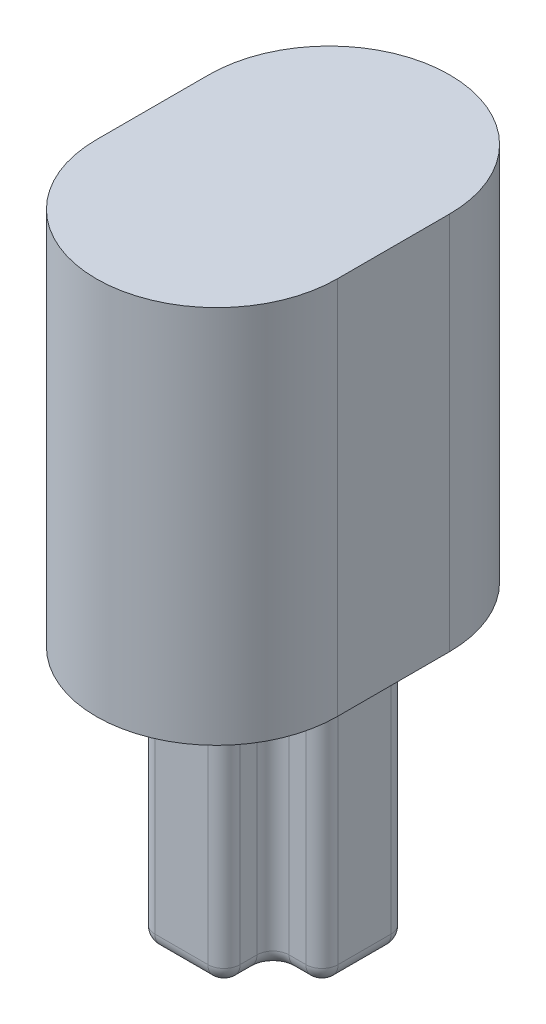
from build123d import *

# Parameters (mm, degrees)
BOSS_EXTRUDE1_DEPTH = 8.1
BOSS_EXTRUDE2_DEPTH = 11.8
FILLET1_R           = 0.5
FILLET2_R           = 0.5
FILLET4_R           = 0.5


with BuildPart() as part:
    # Sketch8 → Boss-Extrude1 (new body)
    with BuildSketch(Plane(origin=(-2.232753674, 0, 0.665681661), x_dir=(-1, 0, 0), z_dir=(0, -1, 0))):
        Polygon((-24.744344877, -18.877779499), (-23.219344877, -18.877779499), (-23.219344877, -21.527779499), (-24.744344877, -21.527779499), (-24.744344877, -23.052779499), (-27.394344877, -23.052779499), (-27.394344877, -21.527779499), (-28.919344877, -21.527779499), (-28.919344877, -18.877779499), (-27.394344877, -18.877779499), (-27.394344877, -17.352779499), (-24.744344877, -17.352779499), align=None)
        Polygon((-26.694344877, -20.827779499), (-26.694344877, -22.352779499), (-25.444344877, -22.352779499), (-25.444344877, -20.827779499), (-23.919344877, -20.827779499), (-23.919344877, -19.577779499), (-25.444344877, -19.577779499), (-25.444344877, -18.052779499), (-26.694344877, -18.052779499), (-26.694344877, -19.577779499), (-28.219344877, -19.577779499), (-28.219344877, -20.827779499), align=None, mode=Mode.SUBTRACT)
    extrude(amount=BOSS_EXTRUDE1_DEPTH)

    # Sketch9 → Boss-Extrude2 (add)
    with BuildSketch(Plane(origin=(0, 0, 0), x_dir=(-1, 0, 0), z_dir=(0, 1, 0))):
        with BuildLine():
            Line((-20.086591203, 22.61846116), (-20.086591203, 19.11846116))
            ThreePointArc((-20.086591203, 19.11846116), (-23.836591203, 15.36846116), (-27.586591203, 19.11846116))
            Line((-27.586591203, 19.11846116), (-27.586591203, 22.61846116))
            ThreePointArc((-27.586591203, 22.61846116), (-23.836591203, 26.36846116), (-20.086591203, 22.61846116))
        make_face()
    extrude(amount=BOSS_EXTRUDE2_DEPTH)

    # Fillet1
    fillet1_edges = [part.edges().sort_by_distance(p)[0] for p in [
        (22.511591203, -4.05, 19.54346116),
        (20.986591203, -4.05, 19.54346116),
        (20.986591203, -4.05, 22.19346116),
        (22.511591203, -4.05, 22.19346116),
        (22.511591203, -4.05, 23.71846116),
        (25.161591203, -4.05, 23.71846116),
        (25.161591203, -4.05, 22.19346116),
        (26.686591203, -4.05, 22.19346116),
        (26.686591203, -4.05, 19.54346116),
        (25.161591203, -4.05, 19.54346116),
        (25.161591203, -4.05, 18.01846116),
        (22.511591203, -4.05, 18.01846116),
    ]]
    fillet(fillet1_edges, radius=FILLET1_R)

    # Fillet2
    fillet2_edges = [part.edges().sort_by_distance(p)[0] for p in [
        (21.749091203, 0, 19.54346116),
        (20.986591203, 0, 20.86846116),
        (21.749091203, 0, 22.19346116),
        (22.511591203, 0, 22.95596116),
        (23.836591203, 0, 23.71846116),
        (25.161591203, 0, 22.95596116),
        (25.924091203, 0, 22.19346116),
        (26.686591203, 0, 20.86846116),
        (25.924091203, 0, 19.54346116),
        (25.161591203, 0, 18.78096116),
        (23.836591203, 0, 18.01846116),
        (25.308037813, 0, 19.39701455),
        (25.308037813, 0, 22.339907769),
        (22.365144594, 0, 22.339907769),
        (22.365144594, 0, 19.39701455),
        (21.133037813, 0, 19.689907769),
        (21.133037813, 0, 22.04701455),
        (22.658037813, 0, 23.57201455),
        (25.015144594, 0, 23.57201455),
        (26.540144594, 0, 22.04701455),
        (26.540144594, 0, 19.689907769),
        (22.658037813, 0, 18.164907769),
        (25.015144594, 0, 18.164907769),
        (22.511591203, 0, 18.78096116),
    ]]
    fillet(fillet2_edges, radius=FILLET2_R)

    # Fillet4
    fillet4_edges = [part.edges().sort_by_distance(p)[0] for p in [
        (21.749091203, -8.1, 19.54346116),
        (20.986591203, -8.1, 20.86846116),
        (23.836591203, -8.1, 18.01846116),
        (25.161591203, -8.1, 18.78096116),
        (25.924091203, -8.1, 19.54346116),
        (26.686591203, -8.1, 20.86846116),
        (25.924091203, -8.1, 22.19346116),
        (25.161591203, -8.1, 22.95596116),
        (23.836591203, -8.1, 23.71846116),
        (22.511591203, -8.1, 22.95596116),
        (21.749091203, -8.1, 22.19346116),
        (25.015144594, -8.1, 18.164907769),
        (22.658037813, -8.1, 18.164907769),
        (26.540144594, -8.1, 19.689907769),
        (26.540144594, -8.1, 22.04701455),
        (25.015144594, -8.1, 23.57201455),
        (22.658037813, -8.1, 23.57201455),
        (21.133037813, -8.1, 22.04701455),
        (21.133037813, -8.1, 19.689907769),
        (22.365144594, -8.1, 19.39701455),
        (22.365144594, -8.1, 22.339907769),
        (25.308037813, -8.1, 22.339907769),
        (25.308037813, -8.1, 19.39701455),
        (22.511591203, -8.1, 18.78096116),
    ]]
    fillet(fillet4_edges, radius=FILLET4_R)


solid = part.part
